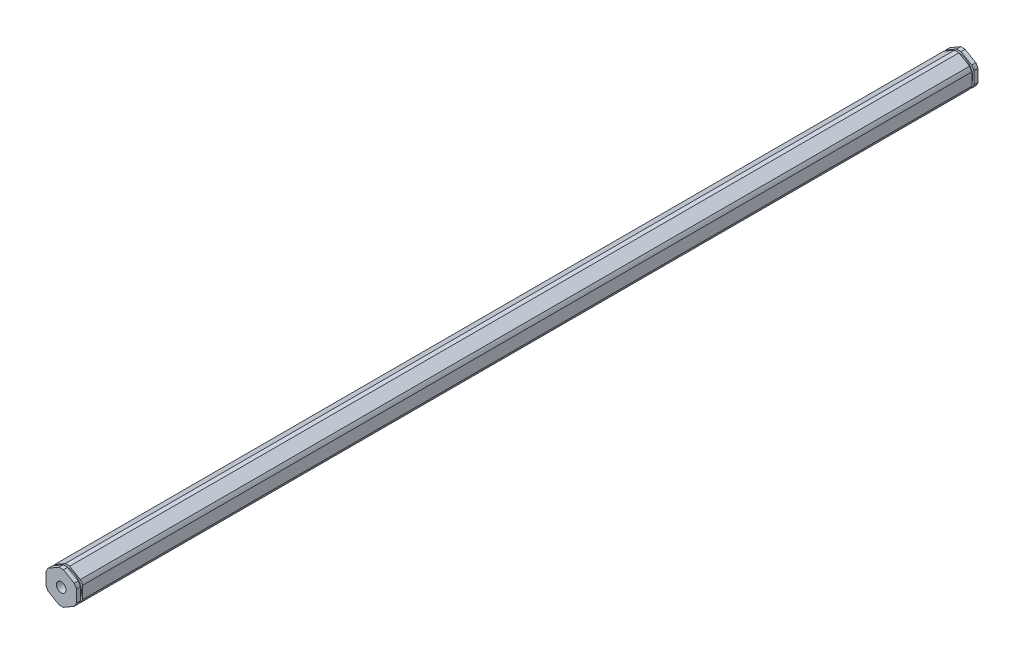
from build123d import *

# Parameters (mm, degrees)
BOSS_EXTRUDE1_DEPTH                  = 188.4045
F_10_32_TAPPED_HOLE1_D               = 4.0386
F_10_32_TAPPED_HOLE1_DEPTH           = 16.34744
F_10_32_TAPPED_HOLE1_TIP             = 1.213317848
F_10_32_TAPPED_HOLE1_ON_FACE_2_D     = 4.0386
F_10_32_TAPPED_HOLE1_ON_FACE_2_DEPTH = 16.34744
F_10_32_TAPPED_HOLE1_ON_FACE_2_TIP   = 1.213317848
SKETCH3_W                            = 0.889
SKETCH3_H                            = 1.0033


with BuildPart() as part:
    # Sketch1 → Boss-Extrude1 (new, symmetric)
    with BuildSketch(Plane.XY):
        with BuildLine():
            ThreePointArc((0.93173274, 6.79441227), (0, 6.858), (-0.93173274, 6.79441227))
            Line((-0.93173274, 6.79441227), (-5.41826726, 4.204110358))
            ThreePointArc((-5.41826726, 4.204110358), (-5.939202219, 3.429), (-6.35, 2.590301913))
            Line((-6.35, 2.590301913), (-6.35, -2.590301913))
            ThreePointArc((-6.35, -2.590301913), (-5.939202219, -3.429), (-5.41826726, -4.204110358))
            Line((-5.41826726, -4.204110358), (-0.93173274, -6.79441227))
            ThreePointArc((-0.93173274, -6.79441227), (0, -6.858), (0.93173274, -6.79441227))
            Line((0.93173274, -6.79441227), (5.41826726, -4.204110358))
            ThreePointArc((5.41826726, -4.204110358), (5.939202219, -3.429), (6.35, -2.590301913))
            Line((6.35, -2.590301913), (6.35, 2.590301913))
            ThreePointArc((6.35, 2.590301913), (5.939202219, 3.429), (5.41826726, 4.204110358))
            Line((5.41826726, 4.204110358), (0.93173274, 6.79441227))
        make_face()
    extrude(amount=BOSS_EXTRUDE1_DEPTH, both=True)

    # #10-32 Tapped Hole1
    with Locations(Plane.XY.offset(188.4045)):
        with Locations((0, 0)):
            Hole(F_10_32_TAPPED_HOLE1_D / 2, depth=F_10_32_TAPPED_HOLE1_DEPTH)
            with Locations((0, 0, -(F_10_32_TAPPED_HOLE1_DEPTH + F_10_32_TAPPED_HOLE1_TIP / 2))):  # 118° drill point
                Cone(0, F_10_32_TAPPED_HOLE1_D / 2, F_10_32_TAPPED_HOLE1_TIP, mode=Mode.SUBTRACT)

    # #10-32 Tapped Hole1 on face 2
    with Locations(Plane(origin=(0, 0, -188.4045), x_dir=(-1, 0, 0), z_dir=(0, 0, -1))):
        with Locations((0, 0)):
            Hole(F_10_32_TAPPED_HOLE1_ON_FACE_2_D / 2, depth=F_10_32_TAPPED_HOLE1_ON_FACE_2_DEPTH)
            with Locations((0, 0, -(F_10_32_TAPPED_HOLE1_ON_FACE_2_DEPTH + F_10_32_TAPPED_HOLE1_ON_FACE_2_TIP / 2))):  # 118° drill point
                Cone(0, F_10_32_TAPPED_HOLE1_ON_FACE_2_D / 2, F_10_32_TAPPED_HOLE1_ON_FACE_2_TIP, mode=Mode.SUBTRACT)

    # Sketch3 → Cut-Revolve1 (revolve, cut)
    with BuildSketch(Plane(origin=(0, 0, 0), x_dir=(0, 0, -1), z_dir=(1, 0, 0)), mode=Mode.PRIVATE) as cut_revolve1_sk:
        with Locations((-186.2455, 6.35635)):
            Rectangle(SKETCH3_W, SKETCH3_H)
    cut_revolve1 = revolve(cut_revolve1_sk.sketch.rotate(Axis((0, 0, 175.157387885), (0, 0, -1)), 90), axis=Axis((0, 0, 175.157387885), (0, 0, -1)), mode=Mode.SUBTRACT)

    # Mirror1: Cut-Revolve1 across plane
    add(cut_revolve1.mirror(Plane.XY), mode=Mode.SUBTRACT)


solid = part.part
